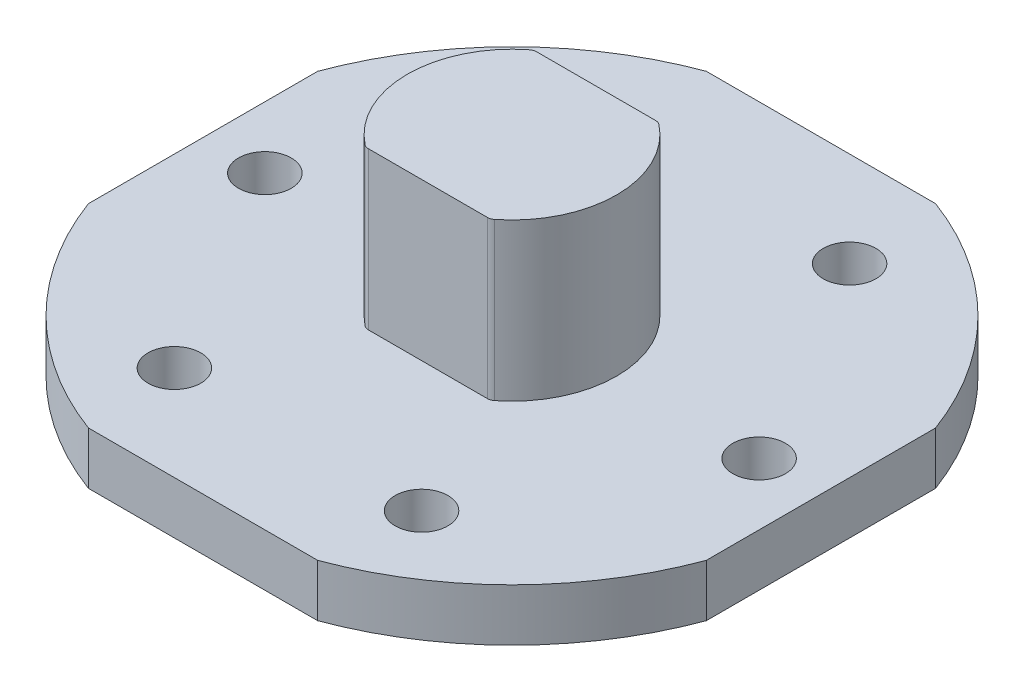
from build123d import *

# Parameters (mm, degrees)
BOSS_EXTRUDE1_DEPTH  = 19.05
BOSS_EXTRUDE2_DEPTH  = 6.35
M6_CLEARANCE_HOLE1_D = 6.4
FILLET1_R            = 1


with BuildPart() as part:
    # Sketch1 → Boss-Extrude1 (new body)
    with BuildSketch(Plane(origin=(0, 0, 0), x_dir=(1, 0, 0), z_dir=(0, 1, 0))):
        with BuildLine():
            Line((-7.566372975, 10.2), (7.566372975, 10.2))
            ThreePointArc((7.566372975, 10.2), (12.7, 0), (7.566372975, -10.2))
            Line((7.566372975, -10.2), (-7.566372975, -10.2))
            ThreePointArc((-7.566372975, -10.2), (-12.7, 0), (-7.566372975, 10.2))
        make_face()
    extrude(amount=BOSS_EXTRUDE1_DEPTH)

    # Sketch1<4> → Boss-Extrude2 (add)
    with BuildSketch(Plane(origin=(0, 0, 0), x_dir=(1, 0, 0), z_dir=(0, 1, 0))):
        with BuildLine():
            Line((13.919410907, 37.5), (-13.919410907, 37.5))
            ThreePointArc((-13.919410907, 37.5), (-28.284271247, 28.284271247), (-37.5, 13.919410907))
            Line((-37.5, 13.919410907), (-37.5, -13.919410907))
            ThreePointArc((-37.5, -13.919410907), (-28.284271247, -28.284271247), (-13.919410907, -37.5))
            Line((-13.919410907, -37.5), (13.919410907, -37.5))
            ThreePointArc((13.919410907, -37.5), (28.284271247, -28.284271247), (37.5, -13.919410907))
            Line((37.5, -13.919410907), (37.5, 13.919410907))
            ThreePointArc((37.5, 13.919410907), (28.284271247, 28.284271247), (13.919410907, 37.5))
        make_face()
    extrude(amount=-BOSS_EXTRUDE2_DEPTH)

    # M6 Clearance Hole1 (through all)
    with Locations(Plane(origin=(-30, 0, 0), x_dir=(0, 0, 1), z_dir=(0, 1, 0))):
        with Locations((0, 0), (-25.980762114, 15), (-25.980762114, 45), (0, 60), (25.980762114, 45), (25.980762114, 15)):
            Hole(M6_CLEARANCE_HOLE1_D / 2)

    # Fillet1
    fillet1_edges = [part.edges().sort_by_distance(p)[0] for p in [
        (-7.566372975, 9.525, 10.2),
        (-7.566372975, 9.525, -10.2),
        (7.566372975, 9.525, -10.2),
        (7.566372975, 9.525, 10.2),
    ]]
    fillet(fillet1_edges, radius=FILLET1_R)


solid = part.part
